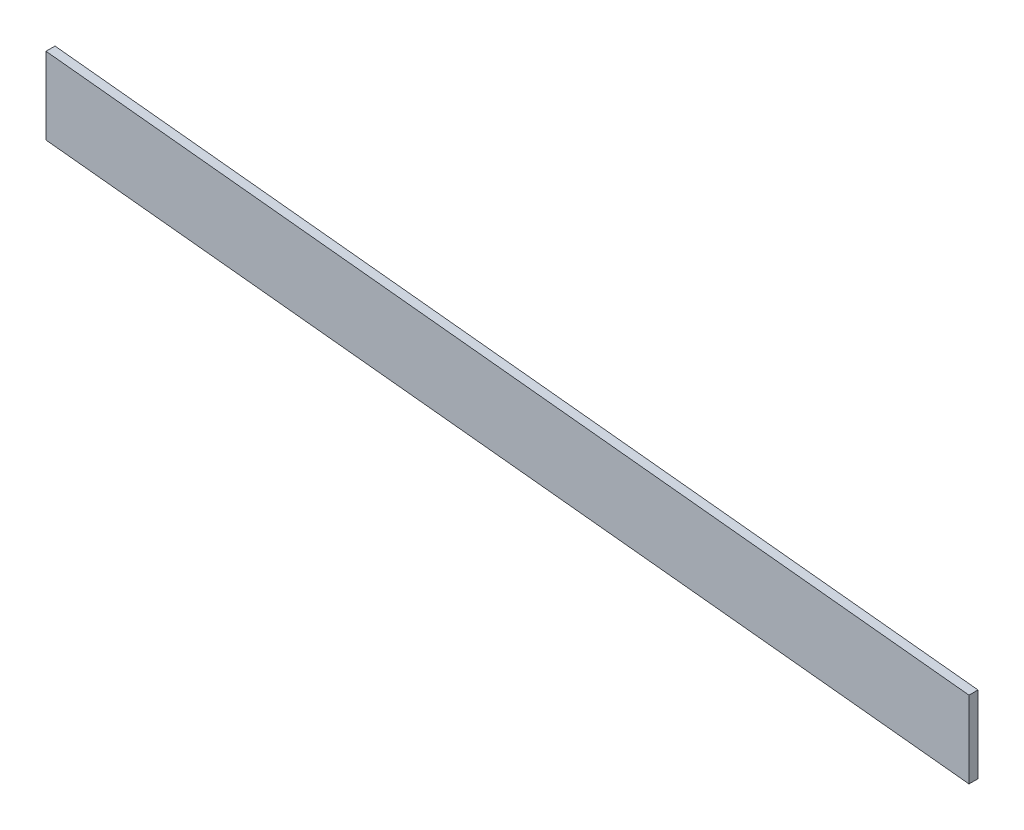
from build123d import *

# Parameters (mm, degrees)
BOSS_EXTRUDE1_DEPTH = 11.90625


with BuildPart() as part:
    # Sketch1 → Boss-Extrude1 (new body)
    with BuildSketch(Plane.XY):
        Polygon((609.6, -114.3), (609.6, -12.7), (-609.6, 114.3), (-609.6, 12.7), align=None)
    extrude(amount=BOSS_EXTRUDE1_DEPTH)


solid = part.part
